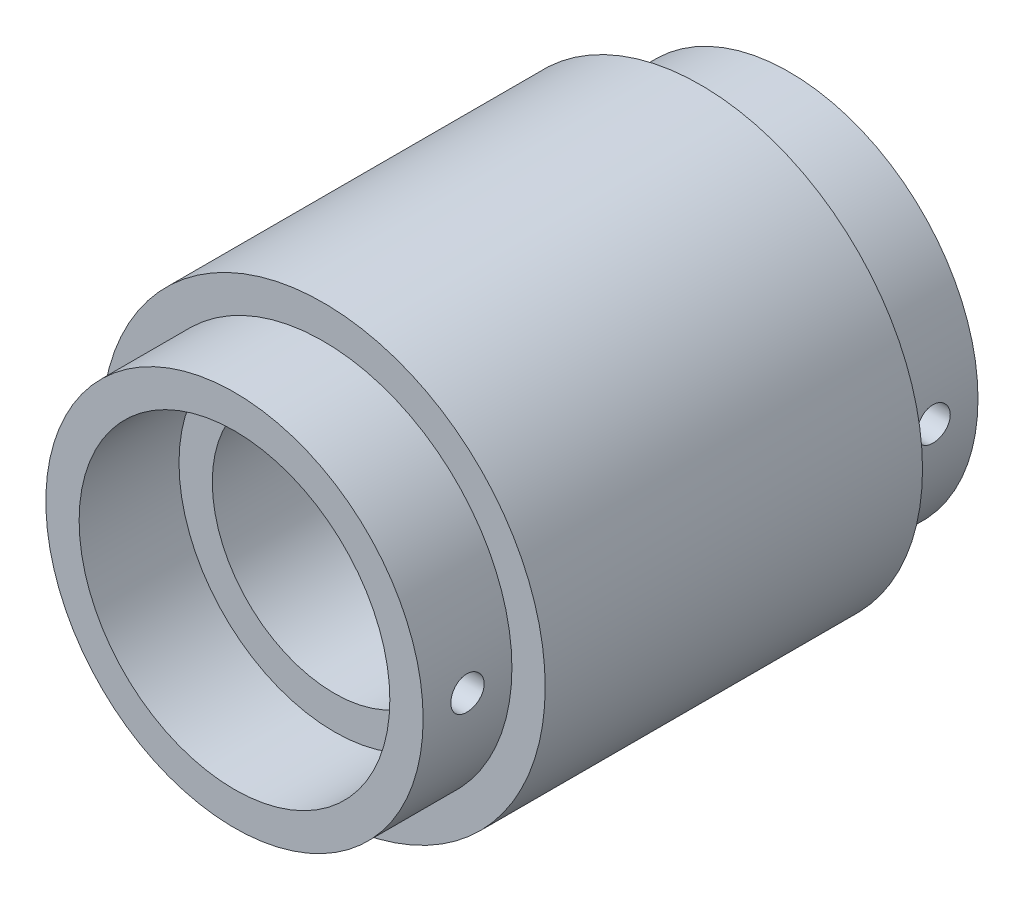
from build123d import *

# Parameters (mm, degrees)
SKETCH1_R               = 20
BOSS_EXTRUDE1_DEPTH     = 25
SKETCH4_R               = 20
SKETCH4_R_2             = 17
CUT_EXTRUDE1_DEPTH      = 8
CUT_EXTRUDE2_REACH      = 39.749
CUT_EXTRUDE2_END_RADIUS = 17
SKETCH5_R               = 1.5


with BuildPart() as part:
    # Sketch1 → Boss-Extrude1 (new, symmetric)
    with BuildSketch(Plane.XY):
        Circle(SKETCH1_R)
    extrude(amount=BOSS_EXTRUDE1_DEPTH, both=True)

    # Sketch3 → Hole1 (revolve, cut)
    with BuildSketch(Plane(origin=(0, 0, 25), x_dir=(0, -1, 0), z_dir=(1, 0, 0))):
        Polygon((0, 0), (0, 56.609466809), (11, 50), (11, 9), (14, 9), (14, 0), align=None)
    hole1 = revolve(axis=Axis((0, 0, 36.310875039), (0, 0, -1)), mode=Mode.SUBTRACT)

    # Sketch4 → Cut-Extrude1 (cut)
    with BuildSketch(Plane.XY.offset(25)):
        Circle(SKETCH4_R)
        Circle(SKETCH4_R_2, mode=Mode.SUBTRACT)
    cut_extrude1 = extrude(amount=-CUT_EXTRUDE1_DEPTH, mode=Mode.SUBTRACT)

    # Mirror2: Hole1, Cut-Extrude1 across plane
    add(hole1.mirror(Plane.XY), mode=Mode.SUBTRACT)
    add(cut_extrude1.mirror(Plane.XY), mode=Mode.SUBTRACT)

    # Cut-Extrude2: up to this cylinder (the profile starts inside it)
    cut_extrude2_end = Plane(origin=(0, 0, 0), z_dir=(0, 0, 1)) * Cylinder(CUT_EXTRUDE2_END_RADIUS, 156.498, mode=Mode.PRIVATE)
    # Sketch5 → Cut-Extrude2 (cut, up to the surface)
    with BuildSketch(Plane(origin=(0, 0, 0), x_dir=(0, 0, -1), z_dir=(1, 0, 0)), mode=Mode.PRIVATE) as cut_extrude2_sk1:
        with Locations(Location((-21, 0, 0), (0, 0, 180))):
            Circle(SKETCH5_R)
    cut_extrude2_tool1 = extrude(cut_extrude2_sk1.sketch, amount=CUT_EXTRUDE2_REACH, mode=Mode.PRIVATE) & cut_extrude2_end
    add(cut_extrude2_tool1.solids().sort_by_distance((0, 0, 21))[0], mode=Mode.SUBTRACT)
    # Sketch5 → Cut-Extrude2 (cut, up to the surface)
    with BuildSketch(Plane(origin=(0, 0, 0), x_dir=(0, 0, -1), z_dir=(1, 0, 0)), mode=Mode.PRIVATE) as cut_extrude2_sk2:
        with Locations(Location((21, 0, 0), (0, 0, 180))):
            Circle(SKETCH5_R)
    cut_extrude2_tool2 = extrude(cut_extrude2_sk2.sketch, amount=CUT_EXTRUDE2_REACH, mode=Mode.PRIVATE) & cut_extrude2_end
    add(cut_extrude2_tool2.solids().sort_by_distance((0, 0, -21))[0], mode=Mode.SUBTRACT)


solid = part.part
